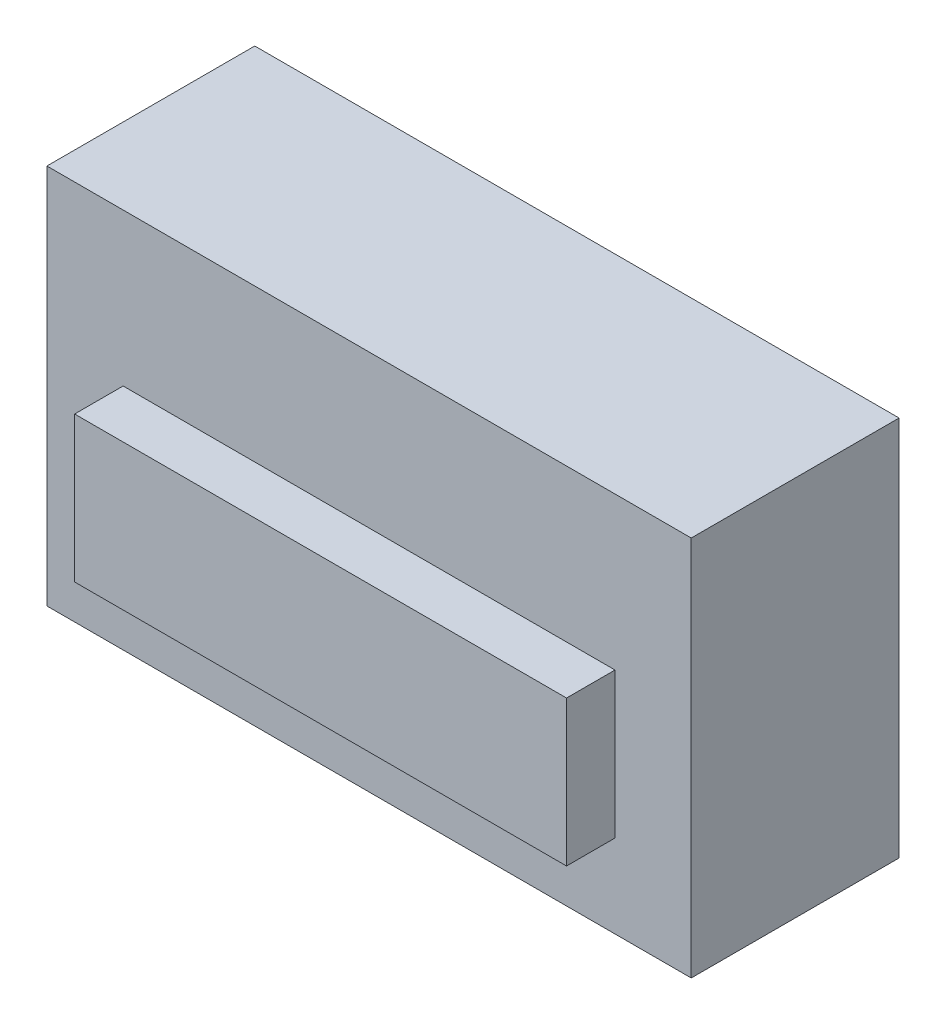
from build123d import *

# Parameters (mm, degrees)
SKETCH1_W           = 93
SKETCH1_H           = 55
BOSS_EXTRUDE1_DEPTH = 30
SKETCH2_W           = 71
SKETCH2_H           = 21
BOSS_EXTRUDE2_DEPTH = 7


with BuildPart() as part:
    # Sketch1 → Boss-Extrude1 (new body)
    with BuildSketch(Plane.XY):
        Rectangle(SKETCH1_W, SKETCH1_H)
    extrude(amount=BOSS_EXTRUDE1_DEPTH)

    # Sketch2 → Boss-Extrude2 (add)
    with BuildSketch(Plane.XY.offset(30)):
        with Locations((0, -5)):
            Rectangle(SKETCH2_W, SKETCH2_H)
    extrude(amount=BOSS_EXTRUDE2_DEPTH)


solid = part.part
